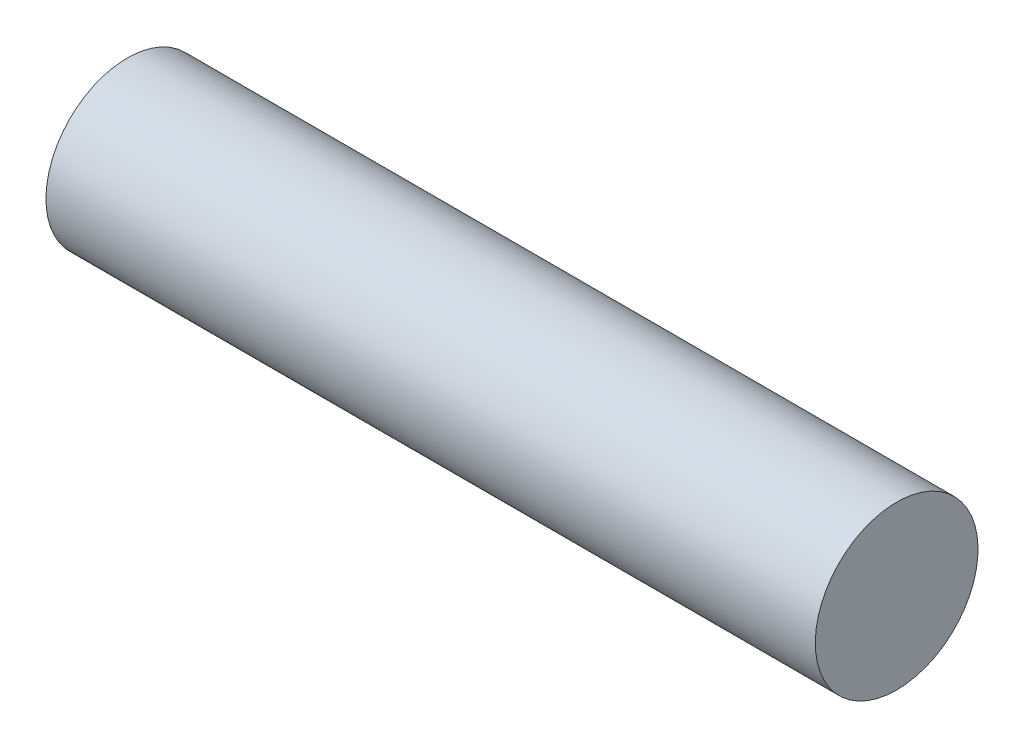
from build123d import *

# Parameters (mm, degrees)
SKETCH1_W = 52
SKETCH1_H = 5.5


with BuildPart() as part:
    # Sketch1 → Revolve1 (revolve)
    with BuildSketch(Plane.XY, mode=Mode.PRIVATE) as revolve1_sk:
        with Locations((0, 2.75)):
            Rectangle(SKETCH1_W, SKETCH1_H)
    revolve(revolve1_sk.sketch.rotate(Axis((-26, 0, 0), (1, 0, 0)), 180), axis=Axis((-26, 0, 0), (1, 0, 0)))


solid = part.part
